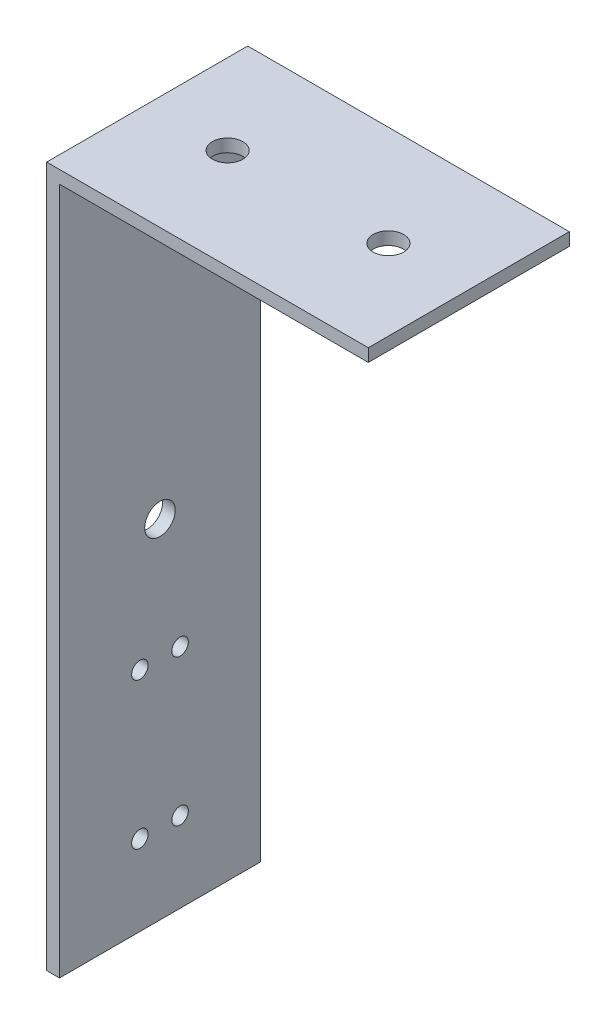
from build123d import *

# Parameters (mm, degrees)
BOSS_EXTRUDE1_DEPTH   = 25
F_6_CLEARANCE_HOLE1_D = 3.7973
F_1_CLEARANCE_HOLE2_D = 2.0574
F_6_CLEARANCE_HOLE2_D = 3.7973


with BuildPart() as part:
    # Sketch2 → Boss-Extrude1 (new body)
    with BuildSketch(Plane.XY):
        Polygon((0, 0), (0, 87.1), (40, 87.1), (40, 85.5125), (1.5875, 85.5125), (1.5875, 0), align=None)
    extrude(amount=BOSS_EXTRUDE1_DEPTH)

    # #6 Clearance Hole1 (through all)
    with Locations(Plane(origin=(0, 87.1, 0), x_dir=(1, 0, 0), z_dir=(0, 1, 0))):
        with Locations((10, -12.5), (30, -12.5)):
            Hole(F_6_CLEARANCE_HOLE1_D / 2)

    # #1 Clearance Hole2 (through all)
    with Locations(Plane.ZY):
        with Locations((15, 10), (15, 28.2), (10, 10), (10, 28.2)):
            Hole(F_1_CLEARANCE_HOLE2_D / 2)

    # #6 Clearance Hole2 (through all)
    with Locations(Plane.ZY):
        with Locations((12.5, 43.2)):
            Hole(F_6_CLEARANCE_HOLE2_D / 2)


solid = part.part
